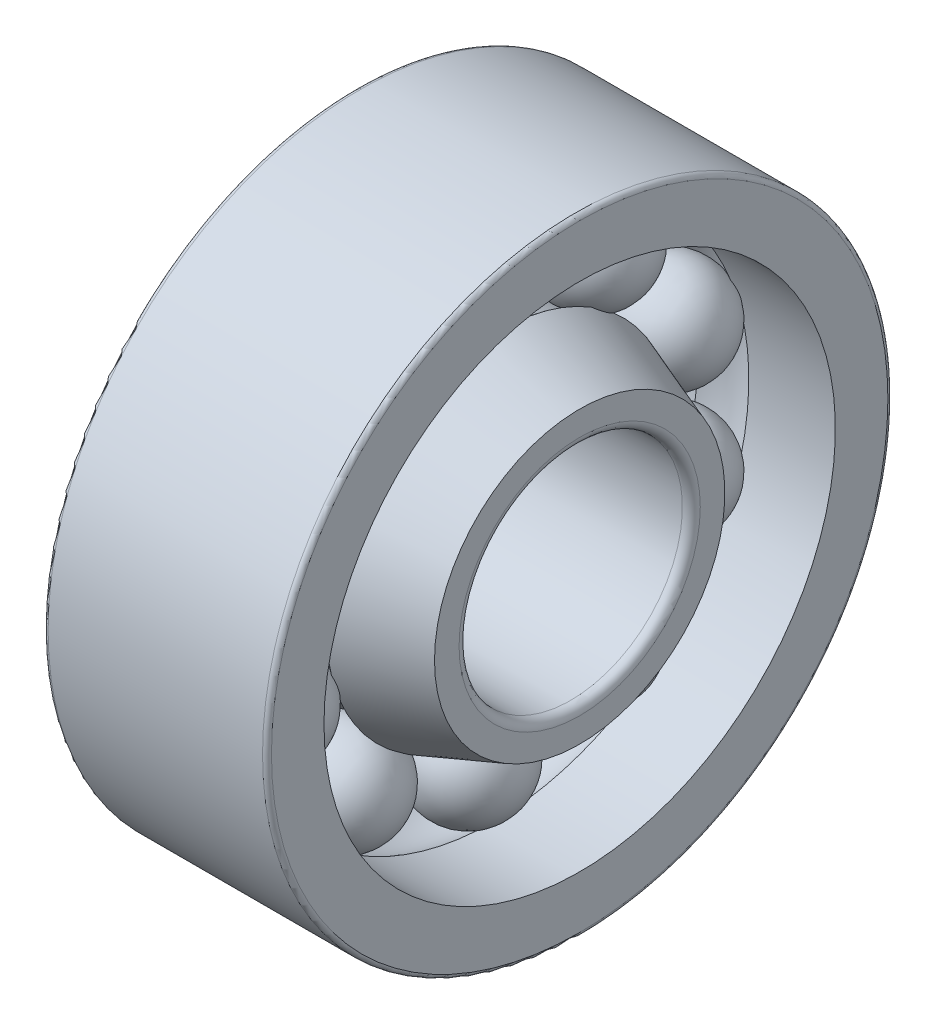
from build123d import *

# Parameters (mm, degrees)
PATTERN_CIRCULAR_1_COUNT = 10
FILLET_1_R               = 0.1
FILLET_2_R               = 0.2


with BuildPart() as part:
    # 草图2 → Revolve 981 (revolve)
    with BuildSketch(Plane.XY, mode=Mode.PRIVATE) as revolve_981_sk:
        with BuildLine():
            Line((5, 3.25), (3.230181509, 3.894161251))
            ThreePointArc((3.230181509, 3.894161251), (2.5, 3.625), (1.769818491, 3.894161251))
            Line((1.769818491, 3.894161251), (0, 3.894161251))
            Line((0, 3.894161251), (0, 2.5))
            Line((0, 2.5), (5, 2.5))
            Line((5, 2.5), (5, 3.25))
        make_face()
    revolve(revolve_981_sk.sketch.rotate(Axis((0, 0, 0), (1, 0, 0)), 90), axis=Axis((0, 0, 0), (1, 0, 0)))

    # 草图3 → 凸台-旋转1 (revolve)
    with BuildSketch(Plane.XY):
        with BuildLine():
            Line((3.675, 4.75), (1.325, 4.75))
            ThreePointArc((1.325, 4.75), (2.5, 5.925), (3.675, 4.75))
        make_face()
    revolve_1 = revolve(axis=Axis((0, 4.75, 0), (1, 0, 0)))

    # 草图4 → 凸台-旋转2 (revolve)
    with BuildSketch(Plane.XY, mode=Mode.PRIVATE) as revolve_2_sk:
        with BuildLine():
            Line((0, 5.724278579), (0, 7))
            Line((0, 7), (5, 7))
            Line((5, 7), (5, 5.724278579))
            Line((5, 5.724278579), (3.0625, 5.724278579))
            ThreePointArc((3.0625, 5.724278579), (2.5, 5.875), (1.9375, 5.724278579))
            Line((1.9375, 5.724278579), (0, 5.724278579))
        make_face()
    revolve(revolve_2_sk.sketch.rotate(Axis((0, 0, 0), (1, 0, 0)), 90), axis=Axis((0, 0, 0), (1, 0, 0)))

    # 阵列(圆周)1: 凸台-旋转1 ×10 about axis
    pattern_circular_1_axis = Axis((0, 0, 0), (1, 0, 0))
    for i in range(1, PATTERN_CIRCULAR_1_COUNT):
        add(revolve_1.rotate(pattern_circular_1_axis, i * 360 / PATTERN_CIRCULAR_1_COUNT))

    # 圆角1
    fillet_1_edges = [part.edges().sort_by_distance(p)[0] for p in [
        (5, 0, -7),
        (0, 0, -7),
        (0, 0, -2.5),
        (0, 0, -3.894161251),
    ]]
    fillet(fillet_1_edges, radius=FILLET_1_R)

    # 圆角2
    fillet_2_edges = [part.edges().sort_by_distance(p)[0] for p in [
        (5, 0, -2.5),
    ]]
    fillet(fillet_2_edges, radius=FILLET_2_R)


solid = part.part
